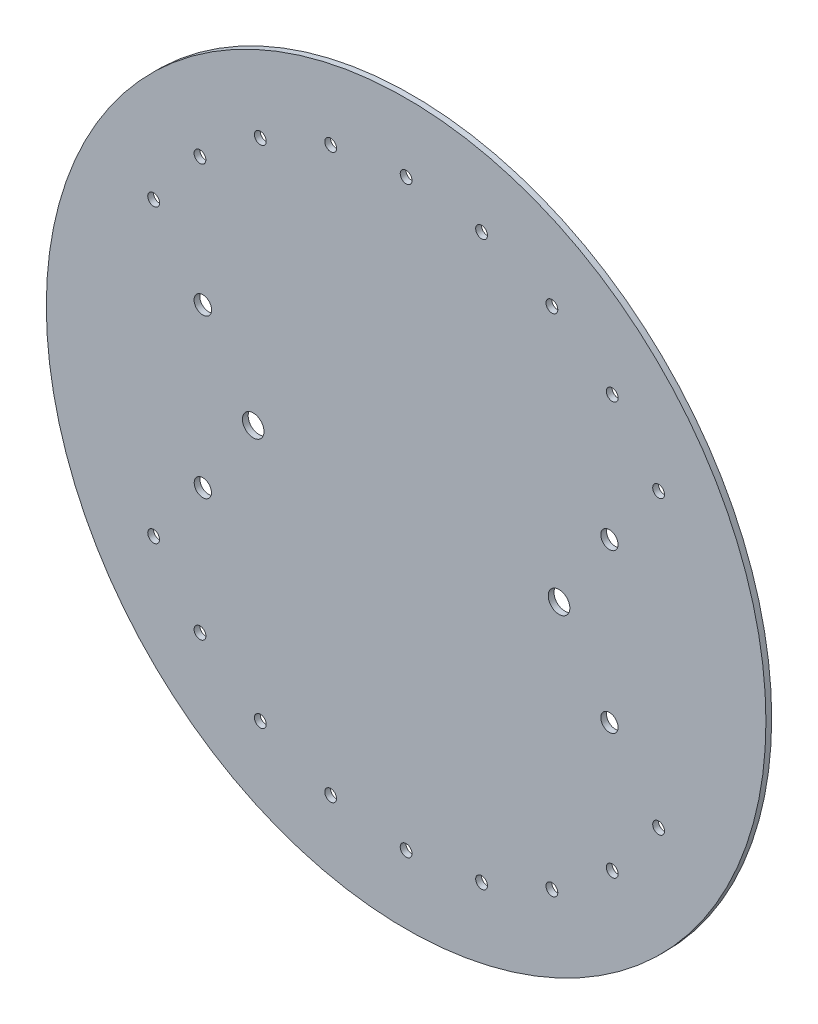
from build123d import *

# Parameters (mm, degrees)
SKETCH1_R               = 250
BOSS_EXTRUDE1_DEPTH     = 4
CUT_EXTRUDE7_DEPTH      = 354.576017286
CUT_EXTRUDE7_DEPTH_BACK = 354.576017286
SKETCH12_R              = 6.1
SKETCH12_R_2            = 7.5
SKETCH12_R_3            = 6
SKETCH12_R_4            = 4.1


with BuildPart() as part:
    # Sketch1 → Boss-Extrude1 (new body)
    with BuildSketch(Plane.XY):
        Circle(SKETCH1_R)
    extrude(amount=BOSS_EXTRUDE1_DEPTH)

    # Sketch12 → Cut-Extrude7 (cut, two sides: drawn at the far end of the back side and taken through both)
    with BuildSketch(Plane.XY.offset(4).offset(-CUT_EXTRUDE7_DEPTH_BACK)):
        with Locations((-141.238075794, 55)):
            Circle(SKETCH12_R)
        with Locations((-106.238075794, 0)):
            Circle(SKETCH12_R_2)
        with Locations((106.238075794, 0)):
            Circle(SKETCH12_R_2)
        with Locations((-141.238075794, -55)):
            Circle(SKETCH12_R_3)
        with Locations((141.238075794, -55)):
            Circle(SKETCH12_R_3)
        with Locations((141.238075794, 55)):
            Circle(SKETCH12_R_3)
        with Locations((0, -202.556165051)):
            Circle(SKETCH12_R_4)
        with Locations((-52.425393218, -195.654231096)):
            Circle(SKETCH12_R_4)
        with Locations((-101.278082525, -175.418784627)):
            Circle(SKETCH12_R_4)
        with Locations((-143.228837878, -143.228837878)):
            Circle(SKETCH12_R_4)
        with Locations((-175.418784627, -101.278082525)):
            Circle(SKETCH12_R_4)
        with Locations((-175.418784627, 101.278082525)):
            Circle(SKETCH12_R_4)
        with Locations((-143.228837878, 143.228837878)):
            Circle(SKETCH12_R_4)
        with Locations((-101.278082525, 175.418784627)):
            Circle(SKETCH12_R_4)
        with Locations((-52.425393218, 195.654231096)):
            Circle(SKETCH12_R_4)
        with Locations((0, 202.556165051)):
            Circle(SKETCH12_R_4)
        with Locations((52.425393218, 195.654231096)):
            Circle(SKETCH12_R_4)
        with Locations((101.278082525, 175.418784627)):
            Circle(SKETCH12_R_4)
        with Locations((143.228837878, 143.228837878)):
            Circle(SKETCH12_R_4)
        with Locations((175.418784627, 101.278082525)):
            Circle(SKETCH12_R_4)
        with Locations((175.418784627, -101.278082525)):
            Circle(SKETCH12_R_4)
        with Locations((143.228837878, -143.228837878)):
            Circle(SKETCH12_R_4)
        with Locations((101.278082525, -175.418784627)):
            Circle(SKETCH12_R_4)
        with Locations((52.425393218, -195.654231096)):
            Circle(SKETCH12_R_4)
    extrude(amount=CUT_EXTRUDE7_DEPTH + CUT_EXTRUDE7_DEPTH_BACK, mode=Mode.SUBTRACT)


solid = part.part
